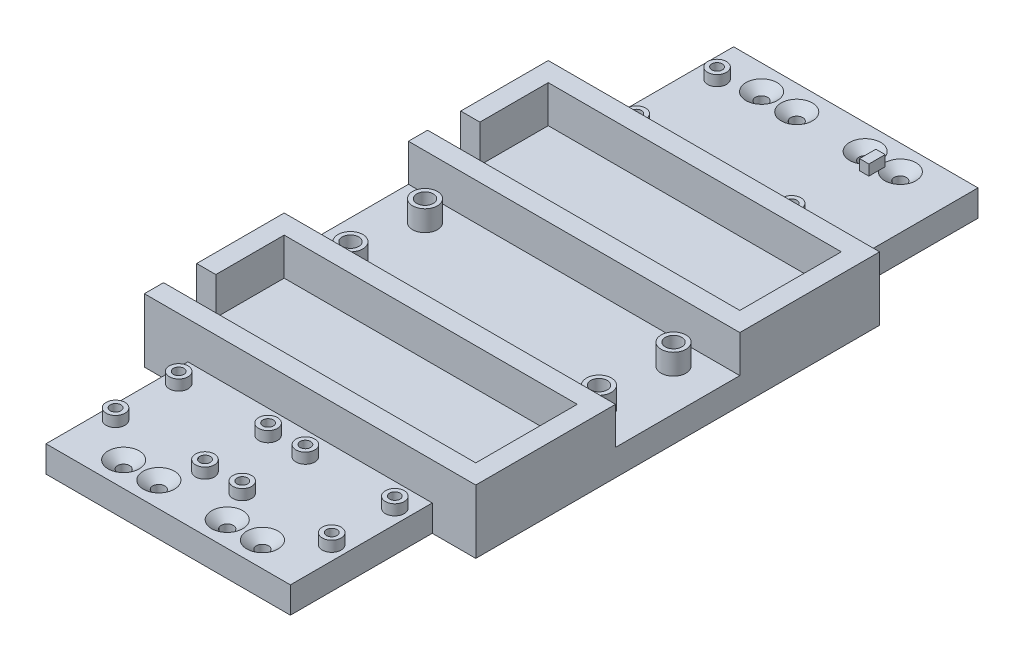
from build123d import *

# Parameters (mm, degrees)
SKETCH2_W                                         = 80
SKETCH2_H                                         = 166
BOSS_EXTRUDE1_DEPTH                               = 6.35
CSK_FOR_4_FLAT_HEAD_MACHINE_SCREW_100_D           = 2.9464
CSK_FOR_4_FLAT_HEAD_MACHINE_SCREW_100_CSINK_D     = 7.5313032
CSK_FOR_4_FLAT_HEAD_MACHINE_SCREW_100_CSINK_ANGLE = 100
MIRROR2_COPY_1_D                                  = 2.9464
MIRROR2_COPY_1_CSINK_D                            = 7.5313032
MIRROR2_COPY_1_CSINK_ANGLE                        = 100
SKETCH9_R                                         = 3
SKETCH9_R_2                                       = 2
BOSS_EXTRUDE3_DEPTH                               = 5
BOSS_EXTRUDE5_DEPTH                               = 9
SKETCH10_R                                        = 2.27
SKETCH10_R_2                                      = 1.27
SKETCH10_W                                        = 2.25
SKETCH10_H                                        = 3.943234712
BOSS_EXTRUDE4_DEPTH                               = 2.54
SKETCH11_R                                        = 2
SKETCH11_R_2                                      = 1.27
CUT_EXTRUDE1_DEPTH                                = 93.574294488
CUT_EXTRUDE2_DEPTH                                = 2.89
SKETCH16_W                                        = 10.5
SKETCH16_H                                        = 34.25
CUT_EXTRUDE4_DEPTH                                = 93.574294488
CUT_EXTRUDE3_DEPTH                                = 3.81


with BuildPart() as part:
    # Sketch2 → Boss-Extrude1 (new body)
    with BuildSketch(Plane(origin=(0, 0, 0), x_dir=(1, 0, 0), z_dir=(0, 1, 0))):
        Rectangle(SKETCH2_W, SKETCH2_H)
    extrude(amount=BOSS_EXTRUDE1_DEPTH)

    # CSK for #4 Flat Head Machine Screw (100)1 (through all)
    with Locations(Plane(origin=(0, 6.35, 0), x_dir=(1, 0, 0), z_dir=(0, 1, 0))):
        with Locations((16.755, 77), (8.255, 77)):
            csk_for_4_flat_head_machine_screw_100 = CounterSinkHole(CSK_FOR_4_FLAT_HEAD_MACHINE_SCREW_100_D / 2, CSK_FOR_4_FLAT_HEAD_MACHINE_SCREW_100_CSINK_D / 2, counter_sink_angle=CSK_FOR_4_FLAT_HEAD_MACHINE_SCREW_100_CSINK_ANGLE)

    # Mirror1: CSK for #4 Flat Head Machine Screw (100)1 across plane
    add(csk_for_4_flat_head_machine_screw_100.mirror(Plane.XY), mode=Mode.SUBTRACT)

    # Mirror2: CSK for #4 Flat Head Machine Screw (100)1 across plane
    add(csk_for_4_flat_head_machine_screw_100.mirror(Plane(origin=(0, 0, 0), x_dir=(0, 0, 1), z_dir=(1, 0, 0))), mode=Mode.SUBTRACT)

    # Mirror2 copy 1 (through all)
    with Locations(Plane(origin=(0, 6.35, 0), x_dir=(-1, 0, 0), z_dir=(0, 1, 0))):
        with Locations((16.755, 77), (8.255, 77)):
            CounterSinkHole(MIRROR2_COPY_1_D / 2, MIRROR2_COPY_1_CSINK_D / 2, counter_sink_angle=MIRROR2_COPY_1_CSINK_ANGLE)

    # Sketch9 → Boss-Extrude3 (add)
    # profile 1 of 4: a face of its own
    with BuildSketch(Plane(origin=(0, 6.35, 0), x_dir=(1, 0, 0), z_dir=(0, 1, 0))):
        with Locations(Location((-30, -9, 0), (0, 0, 270))):
            Circle(SKETCH9_R)
        with Locations(Location((-30, -9, 0), (0, 0, 270))):
            Circle(SKETCH9_R_2, mode=Mode.SUBTRACT)
    # profile 2 of 4: a face of its own
    with BuildSketch(Plane(origin=(0, 6.35, 0), x_dir=(1, 0, 0), z_dir=(0, 1, 0))):
        with Locations(Location((-30, 9, 0), (0, 0, 270))):
            Circle(SKETCH9_R)
        with Locations(Location((-30, 9, 0), (0, 0, 270))):
            Circle(SKETCH9_R_2, mode=Mode.SUBTRACT)
    # profile 3 of 4: a face of its own
    with BuildSketch(Plane(origin=(0, 6.35, 0), x_dir=(1, 0, 0), z_dir=(0, 1, 0))):
        with Locations(Location((30, 9, 0), (0, 0, 270))):
            Circle(SKETCH9_R)
        with Locations(Location((30, 9, 0), (0, 0, 270))):
            Circle(SKETCH9_R_2, mode=Mode.SUBTRACT)
    # profile 4 of 4: a face of its own
    with BuildSketch(Plane(origin=(0, 6.35, 0), x_dir=(1, 0, 0), z_dir=(0, 1, 0))):
        with Locations(Location((30, -9, 0), (0, 0, 270))):
            Circle(SKETCH9_R)
        with Locations(Location((30, -9, 0), (0, 0, 270))):
            Circle(SKETCH9_R_2, mode=Mode.SUBTRACT)
    extrude(amount=BOSS_EXTRUDE3_DEPTH)

    # Sketch15 → Boss-Extrude5 (add)
    with BuildSketch(Plane(origin=(0, 6.35, 0), x_dir=(1, 0, 0), z_dir=(0, 1, 0))):
        Polygon((-35.375, 44.125), (35.375, 44.125), (35.375, 19.625), (-40, 19.625), (-40, 15), (40, 15), (40, 48.75), (-40, 48.75), (-40, 27.625), (-35.375, 27.625), align=None)
        Polygon((-40, -15), (40, -15), (40, -48.75), (-40, -48.75), (-40, -44.125), (35.375, -44.125), (35.375, -19.625), (-35.375, -19.625), (-35.375, -36.125), (-40, -36.125), align=None)
    extrude(amount=BOSS_EXTRUDE5_DEPTH)

    # Sketch10 → Boss-Extrude4 (add)
    # profile 1 of 12: a face of its own
    with BuildSketch(Plane(origin=(0, 6.35, 0), x_dir=(1, 0, 0), z_dir=(0, 1, 0))):
        with Locations(Location((-4.5, -54.38, 0), (0, 0, 270))):
            Circle(SKETCH10_R)
        with Locations(Location((-4.5, -54.38, 0), (0, 0, 270))):
            Circle(SKETCH10_R_2, mode=Mode.SUBTRACT)
    # profile 2 of 12: a face of its own
    with BuildSketch(Plane(origin=(0, 6.35, 0), x_dir=(1, 0, 0), z_dir=(0, 1, 0))):
        with Locations(Location((-4.5, -69.62, 0), (0, 0, 270))):
            Circle(SKETCH10_R)
        with Locations(Location((-4.5, -69.62, 0), (0, 0, 270))):
            Circle(SKETCH10_R_2, mode=Mode.SUBTRACT)
    # profile 3 of 12: a face of its own
    with BuildSketch(Plane(origin=(0, 6.35, 0), x_dir=(1, 0, 0), z_dir=(0, 1, 0))):
        with Locations(Location((-26.09, -54.38, 0), (0, 0, 270))):
            Circle(SKETCH10_R)
        with Locations(Location((-26.09, -54.38, 0), (0, 0, 270))):
            Circle(SKETCH10_R_2, mode=Mode.SUBTRACT)
    # profile 4 of 12: a face of its own
    with BuildSketch(Plane(origin=(0, 6.35, 0), x_dir=(1, 0, 0), z_dir=(0, 1, 0))):
        with Locations(Location((-26.09, -69.62, 0), (0, 0, 270))):
            Circle(SKETCH10_R)
        with Locations(Location((-26.09, -69.62, 0), (0, 0, 270))):
            Circle(SKETCH10_R_2, mode=Mode.SUBTRACT)
    # profile 5 of 12: a face of its own
    with BuildSketch(Plane(origin=(0, 6.35, 0), x_dir=(1, 0, 0), z_dir=(0, 1, 0))):
        with Locations(Location((4.5, -54.38, 0), (0, 0, 270))):
            Circle(SKETCH10_R)
        with Locations(Location((4.5, -54.38, 0), (0, 0, 270))):
            Circle(SKETCH10_R_2, mode=Mode.SUBTRACT)
    # profile 6 of 12: a face of its own
    with BuildSketch(Plane(origin=(0, 6.35, 0), x_dir=(1, 0, 0), z_dir=(0, 1, 0))):
        with Locations(Location((4.5, -69.62, 0), (0, 0, 270))):
            Circle(SKETCH10_R)
        with Locations(Location((4.5, -69.62, 0), (0, 0, 270))):
            Circle(SKETCH10_R_2, mode=Mode.SUBTRACT)
    # profile 7 of 12: a face of its own
    with BuildSketch(Plane(origin=(0, 6.35, 0), x_dir=(1, 0, 0), z_dir=(0, 1, 0))):
        with Locations(Location((26.09, -69.62, 0), (0, 0, 270))):
            Circle(SKETCH10_R)
        with Locations(Location((26.09, -69.62, 0), (0, 0, 270))):
            Circle(SKETCH10_R_2, mode=Mode.SUBTRACT)
    # profile 8 of 12: a face of its own
    with BuildSketch(Plane(origin=(0, 6.35, 0), x_dir=(1, 0, 0), z_dir=(0, 1, 0))):
        with Locations(Location((26.09, -54.38, 0), (0, 0, 270))):
            Circle(SKETCH10_R)
        with Locations(Location((26.09, -54.38, 0), (0, 0, 270))):
            Circle(SKETCH10_R_2, mode=Mode.SUBTRACT)
    # profile 9 of 12: a face of its own
    with BuildSketch(Plane(origin=(0, 6.35, 0), x_dir=(1, 0, 0), z_dir=(0, 1, 0))):
        with Locations(Location((12.75, 54.75, 0), (0, 0, 270))):
            Circle(SKETCH10_R)
        with Locations(Location((12.75, 54.75, 0), (0, 0, 270))):
            Circle(SKETCH10_R_2, mode=Mode.SUBTRACT)
    # profile 10 of 12: a face of its own
    with BuildSketch(Plane(origin=(0, 6.35, 0), x_dir=(1, 0, 0), z_dir=(0, 1, 0))):
        with Locations(Location((-24.75, 54.75, 0), (0, 0, 270))):
            Circle(SKETCH10_R)
        with Locations(Location((-24.75, 54.75, 0), (0, 0, 270))):
            Circle(SKETCH10_R_2, mode=Mode.SUBTRACT)
    # profile 11 of 12: a face of its own
    with BuildSketch(Plane(origin=(0, 6.35, 0), x_dir=(1, 0, 0), z_dir=(0, 1, 0))):
        with Locations(Location((-24.75, 74.25, 0), (0, 0, 270))):
            Circle(SKETCH10_R)
        with Locations(Location((-24.75, 74.25, 0), (0, 0, 270))):
            Circle(SKETCH10_R_2, mode=Mode.SUBTRACT)
    # profile 12 of 12: a face of its own
    with BuildSketch(Plane(origin=(0, 6.35, 0), x_dir=(1, 0, 0), z_dir=(0, 1, 0))):
        with Locations((12.75, 74.25)):
            Rectangle(SKETCH10_W, SKETCH10_H)
    extrude(amount=BOSS_EXTRUDE4_DEPTH)

    # Sketch11 → Cut-Extrude1 (cut, through all)
    with BuildSketch(Plane(origin=(0, 6.35, 0), x_dir=(1, 0, 0), z_dir=(0, 1, 0))):
        with Locations(Location((-30, -9, 0), (0, 0, 270))):
            Circle(SKETCH11_R)
        with Locations(Location((-30, 9, 0), (0, 0, 270))):
            Circle(SKETCH11_R)
        with Locations(Location((26.09, -54.38, 0), (0, 0, 270))):
            Circle(SKETCH11_R_2)
        with Locations(Location((26.09, -69.62, 0), (0, 0, 270))):
            Circle(SKETCH11_R_2)
        with Locations(Location((4.5, -54.38, 0), (0, 0, 270))):
            Circle(SKETCH11_R_2)
        with Locations(Location((4.5, -69.62, 0), (0, 0, 270))):
            Circle(SKETCH11_R_2)
        with Locations(Location((30, 9, 0), (0, 0, 270))):
            Circle(SKETCH11_R)
        with Locations(Location((30, -9, 0), (0, 0, 270))):
            Circle(SKETCH11_R)
        with Locations(Location((-26.09, -69.62, 0), (0, 0, 270))):
            Circle(SKETCH11_R_2)
        with Locations(Location((-26.09, -54.38, 0), (0, 0, 270))):
            Circle(SKETCH11_R_2)
        with Locations(Location((-4.5, -69.62, 0), (0, 0, 270))):
            Circle(SKETCH11_R_2)
        with Locations(Location((-4.5, -54.38, 0), (0, 0, 270))):
            Circle(SKETCH11_R_2)
        with Locations(Location((12.75, 54.75, 0), (0, 0, 270))):
            Circle(SKETCH11_R_2)
        with Locations(Location((-24.75, 54.75, 0), (0, 0, 270))):
            Circle(SKETCH11_R_2)
        with Locations(Location((-24.75, 74.25, 0), (0, 0, 270))):
            Circle(SKETCH11_R_2)
    extrude(amount=-CUT_EXTRUDE1_DEPTH, mode=Mode.SUBTRACT)

    # Sketch12 → Cut-Extrude2 (cut)
    with BuildSketch(Plane.XZ):
        Polygon((-23.59, 52.936624327), (-23.59, 55.823375673), (-26.09, 57.266751346), (-28.59, 55.823375673), (-28.59, 52.936624327), (-26.09, 51.493248654), align=None)
        Polygon((-2, 52.936624327), (-2, 55.823375673), (-4.5, 57.266751346), (-7, 55.823375673), (-7, 52.936624327), (-4.5, 51.493248654), align=None)
        Polygon((-23.59, 68.176624327), (-23.59, 71.063375673), (-26.09, 72.506751346), (-28.59, 71.063375673), (-28.59, 68.176624327), (-26.09, 66.733248654), align=None)
        Polygon((-2, 68.176624327), (-2, 71.063375673), (-4.5, 72.506751346), (-7, 71.063375673), (-7, 68.176624327), (-4.5, 66.733248654), align=None)
        Polygon((7, 52.936624327), (7, 55.823375673), (4.5, 57.266751346), (2, 55.823375673), (2, 52.936624327), (4.5, 51.493248654), align=None)
        Polygon((7, 68.176624327), (7, 71.063375673), (4.5, 72.506751346), (2, 71.063375673), (2, 68.176624327), (4.5, 66.733248654), align=None)
        Polygon((28.59, 68.176624327), (28.59, 71.063375673), (26.09, 72.506751346), (23.59, 71.063375673), (23.59, 68.176624327), (26.09, 66.733248654), align=None)
        Polygon((28.59, 52.936624327), (28.59, 55.823375673), (26.09, 57.266751346), (23.59, 55.823375673), (23.59, 52.936624327), (26.09, 51.493248654), align=None)
        Polygon((-22.25, -75.693375673), (-22.25, -72.806624327), (-24.75, -71.363248654), (-27.25, -72.806624327), (-27.25, -75.693375673), (-24.75, -77.136751346), align=None)
        Polygon((-22.25, -56.193375673), (-22.25, -53.306624327), (-24.75, -51.863248654), (-27.25, -53.306624327), (-27.25, -56.193375673), (-24.75, -57.636751346), align=None)
        Polygon((15.25, -56.193375673), (15.25, -53.306624327), (12.75, -51.863248654), (10.25, -53.306624327), (10.25, -56.193375673), (12.75, -57.636751346), align=None)
    extrude(amount=-CUT_EXTRUDE2_DEPTH, mode=Mode.SUBTRACT)

    # Sketch16 → Cut-Extrude4 (cut, through all)
    with BuildSketch(Plane(origin=(0, 6.35, 0), x_dir=(1, 0, 0), z_dir=(0, 1, 0))):
        with Locations((34.75, 65.875)):
            Rectangle(SKETCH16_W, SKETCH16_H)
        with Locations((-34.75, 65.875)):
            Rectangle(SKETCH16_W, SKETCH16_H)
        with Locations((-34.75, -65.875)):
            Rectangle(SKETCH16_W, SKETCH16_H)
        with Locations((34.75, -65.875)):
            Rectangle(SKETCH16_W, SKETCH16_H)
    extrude(amount=-CUT_EXTRUDE4_DEPTH, mode=Mode.SUBTRACT)

    # Sketch14 → Cut-Extrude3 (cut)
    with BuildSketch(Plane.XZ):
        Polygon((33.175, 7.166912895), (33.175, 10.833087105), (30, 12.666174209), (26.825, 10.833087105), (26.825, 7.166912895), (30, 5.333825791), align=None)
        Polygon((26.825, -10.833087105), (30, -12.666174209), (33.175, -10.833087105), (33.175, -7.166912895), (30, -5.333825791), (26.825, -7.166912895), align=None)
        Polygon((-26.825, 10.833087105), (-30, 12.666174209), (-33.175, 10.833087105), (-33.175, 7.166912895), (-30, 5.333825791), (-26.825, 7.166912895), align=None)
        Polygon((-33.175, -10.833087105), (-30, -12.666174209), (-26.825, -10.833087105), (-26.825, -7.166912895), (-30, -5.333825791), (-33.175, -7.166912895), align=None)
    extrude(amount=-CUT_EXTRUDE3_DEPTH, mode=Mode.SUBTRACT)


solid = part.part
